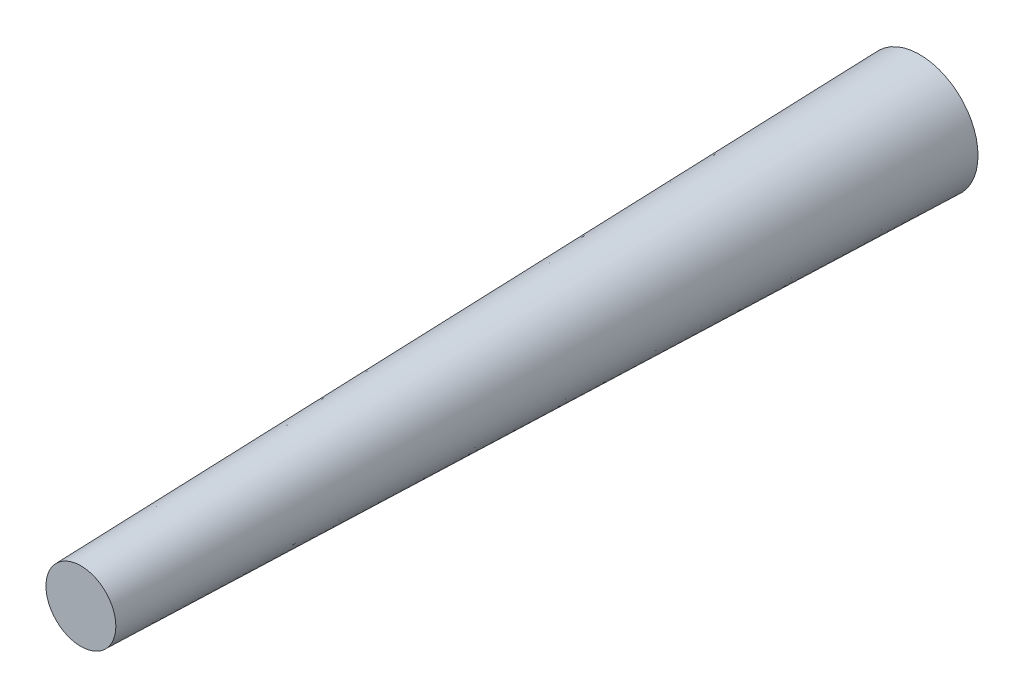
from build123d import *


with BuildPart() as part:
    # Sketch1 → Revolve1 (revolve)
    with BuildSketch(Plane(origin=(0, 0, 0), x_dir=(0, 0, -1), z_dir=(1, 0, 0)), mode=Mode.PRIVATE) as revolve1_sk:
        Polygon((-18, 0), (18, 0), (18.0001, 2.5), (-18, 1.5), align=None)
    revolve(revolve1_sk.sketch.rotate(Axis((0, 0, 18), (0, 0, -1)), 90), axis=Axis((0, 0, 18), (0, 0, -1)))


solid = part.part
